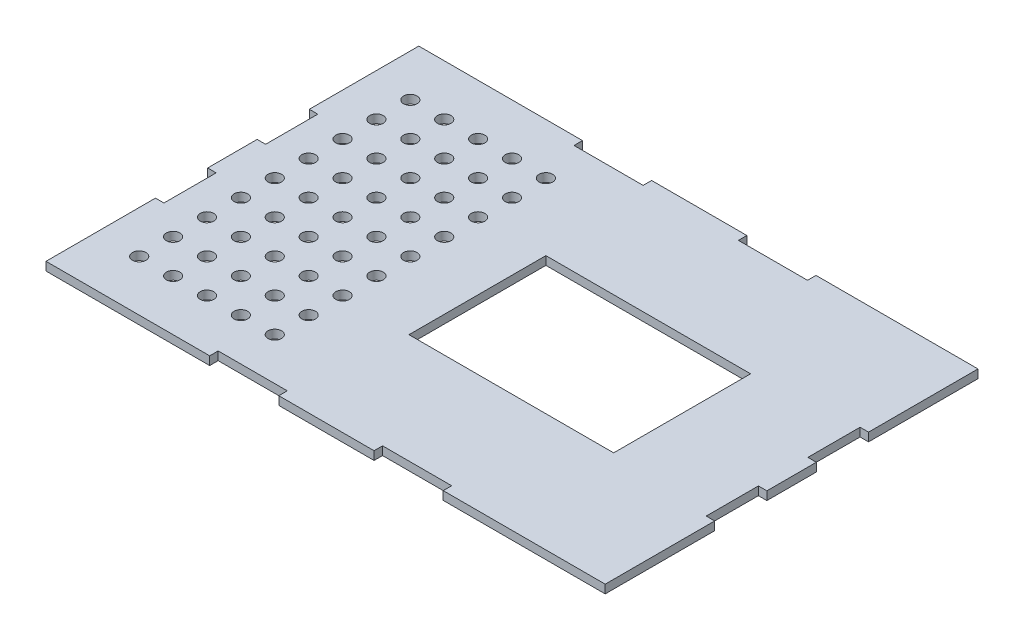
from build123d import *

# Parameters (mm, degrees)
SKETCH1_W           = 203.2
SKETCH1_H           = 133.35
BOSS_EXTRUDE1_DEPTH = 3.175
SKETCH2_R           = 2.54
CUT_EXTRUDE1_DEPTH  = 122.565604716
SKETCH3_W           = 35.687
SKETCH3_H           = 3.175
BOSS_EXTRUDE2_DEPTH = 3.175
SKETCH4_W           = 3.175
SKETCH4_H           = 18.542
BOSS_EXTRUDE3_DEPTH = 3.175
BOSS_EXTRUDE4_DEPTH = 3.175
SKETCH6_W           = 76.708
SKETCH6_H           = 51.308
CUT_EXTRUDE2_DEPTH  = 126.963898598


with BuildPart() as part:
    # Sketch1 → Boss-Extrude1 (new body)
    with BuildSketch(Plane(origin=(0, 0, 0), x_dir=(1, 0, 0), z_dir=(0, 1, 0))):
        Rectangle(SKETCH1_W, SKETCH1_H)
    extrude(amount=BOSS_EXTRUDE1_DEPTH)

    # Sketch2 → Cut-Extrude1 (cut, through all)
    with BuildSketch(Plane(origin=(0, 3.175, 0), x_dir=(1, 0, 0), z_dir=(0, 1, 0))):
        with Locations(Location((-88.9, 50.8, 0), (0, 0, 270))):
            Circle(SKETCH2_R)
        with Locations(Location((-76.2, 50.8, 0), (0, 0, 270))):
            Circle(SKETCH2_R)
        with Locations(Location((-63.5, 50.8, 0), (0, 0, 270))):
            Circle(SKETCH2_R)
        with Locations(Location((-50.8, 50.8, 0), (0, 0, 270))):
            Circle(SKETCH2_R)
        with Locations(Location((-76.2, 38.1, 0), (0, 0, 270))):
            Circle(SKETCH2_R)
        with Locations(Location((-63.5, 38.1, 0), (0, 0, 270))):
            Circle(SKETCH2_R)
        with Locations(Location((-50.8, 38.1, 0), (0, 0, 270))):
            Circle(SKETCH2_R)
        with Locations(Location((-76.2, 25.4, 0), (0, 0, 270))):
            Circle(SKETCH2_R)
        with Locations(Location((-63.5, 25.4, 0), (0, 0, 270))):
            Circle(SKETCH2_R)
        with Locations(Location((-50.8, 25.4, 0), (0, 0, 270))):
            Circle(SKETCH2_R)
        with Locations(Location((-76.2, 12.7, 0), (0, 0, 270))):
            Circle(SKETCH2_R)
        with Locations(Location((-63.5, 12.7, 0), (0, 0, 270))):
            Circle(SKETCH2_R)
        with Locations(Location((-50.8, 12.7, 0), (0, 0, 270))):
            Circle(SKETCH2_R)
        with Locations(Location((-76.2, 0, 0), (0, 0, 270))):
            Circle(SKETCH2_R)
        with Locations(Location((-63.5, 0, 0), (0, 0, 270))):
            Circle(SKETCH2_R)
        with Locations(Location((-50.8, 0, 0), (0, 0, 270))):
            Circle(SKETCH2_R)
        with Locations(Location((-76.2, -12.7, 0), (0, 0, 270))):
            Circle(SKETCH2_R)
        with Locations(Location((-63.5, -12.7, 0), (0, 0, 270))):
            Circle(SKETCH2_R)
        with Locations(Location((-50.8, -12.7, 0), (0, 0, 270))):
            Circle(SKETCH2_R)
        with Locations(Location((-76.2, -25.4, 0), (0, 0, 270))):
            Circle(SKETCH2_R)
        with Locations(Location((-63.5, -25.4, 0), (0, 0, 270))):
            Circle(SKETCH2_R)
        with Locations(Location((-50.8, -25.4, 0), (0, 0, 270))):
            Circle(SKETCH2_R)
        with Locations(Location((-76.2, -38.1, 0), (0, 0, 270))):
            Circle(SKETCH2_R)
        with Locations(Location((-63.5, -38.1, 0), (0, 0, 270))):
            Circle(SKETCH2_R)
        with Locations(Location((-50.8, -38.1, 0), (0, 0, 270))):
            Circle(SKETCH2_R)
        with Locations(Location((-76.2, -50.8, 0), (0, 0, 270))):
            Circle(SKETCH2_R)
        with Locations(Location((-63.5, -50.8, 0), (0, 0, 270))):
            Circle(SKETCH2_R)
        with Locations(Location((-50.8, -50.8, 0), (0, 0, 270))):
            Circle(SKETCH2_R)
        with Locations(Location((-88.9, 38.1, 0), (0, 0, 270))):
            Circle(SKETCH2_R)
        with Locations(Location((-88.9, 25.4, 0), (0, 0, 270))):
            Circle(SKETCH2_R)
        with Locations(Location((-88.9, 12.7, 0), (0, 0, 270))):
            Circle(SKETCH2_R)
        with Locations(Location((-88.9, 0, 0), (0, 0, 270))):
            Circle(SKETCH2_R)
        with Locations(Location((-88.9, -12.7, 0), (0, 0, 270))):
            Circle(SKETCH2_R)
        with Locations(Location((-88.9, -25.4, 0), (0, 0, 270))):
            Circle(SKETCH2_R)
        with Locations(Location((-88.9, -38.1, 0), (0, 0, 270))):
            Circle(SKETCH2_R)
        with Locations(Location((-88.9, -50.8, 0), (0, 0, 270))):
            Circle(SKETCH2_R)
        with Locations(Location((-38.1, 50.8, 0), (0, 0, 270))):
            Circle(SKETCH2_R)
        with Locations(Location((-38.1, 38.1, 0), (0, 0, 270))):
            Circle(SKETCH2_R)
        with Locations(Location((-38.1, 25.4, 0), (0, 0, 270))):
            Circle(SKETCH2_R)
        with Locations(Location((-38.1, 12.7, 0), (0, 0, 270))):
            Circle(SKETCH2_R)
        with Locations(Location((-38.1, 0, 0), (0, 0, 270))):
            Circle(SKETCH2_R)
        with Locations(Location((-38.1, -12.7, 0), (0, 0, 270))):
            Circle(SKETCH2_R)
        with Locations(Location((-38.1, -25.4, 0), (0, 0, 270))):
            Circle(SKETCH2_R)
        with Locations(Location((-38.1, -38.1, 0), (0, 0, 270))):
            Circle(SKETCH2_R)
        with Locations(Location((-38.1, -50.8, 0), (0, 0, 270))):
            Circle(SKETCH2_R)
    extrude(amount=-CUT_EXTRUDE1_DEPTH, mode=Mode.SUBTRACT)

    # Sketch3 → Boss-Extrude2 (add)
    with BuildSketch(Plane(origin=(0, 3.175, 0), x_dir=(1, 0, 0), z_dir=(0, 1, 0))):
        with Locations((-61.2775, 68.2625)):
            Rectangle(SKETCH3_W, SKETCH3_H)
        with Locations((0.3175, 68.2625)):
            Rectangle(SKETCH3_W, SKETCH3_H)
        with Locations((61.9125, 68.2625)):
            Rectangle(SKETCH3_W, SKETCH3_H)
        with Locations((61.9125, -68.2625)):
            Rectangle(SKETCH3_W, SKETCH3_H)
        with Locations((0.3175, -68.2625)):
            Rectangle(SKETCH3_W, SKETCH3_H)
        with Locations((-61.2775, -68.2625)):
            Rectangle(SKETCH3_W, SKETCH3_H)
    extrude(amount=-BOSS_EXTRUDE2_DEPTH)

    # Sketch4 → Boss-Extrude3 (add)
    with BuildSketch(Plane(origin=(0, 3.175, 0), x_dir=(1, 0, 0), z_dir=(0, 1, 0))):
        with Locations((-103.1875, 38.1)):
            Rectangle(SKETCH4_W, SKETCH4_H)
        with Locations((-103.1875, 0)):
            Rectangle(SKETCH4_W, SKETCH4_H)
        with Locations((-103.1875, -38.1)):
            Rectangle(SKETCH4_W, SKETCH4_H)
        with Locations((103.1875, -38.1)):
            Rectangle(SKETCH4_W, SKETCH4_H)
        with Locations((103.1875, 0)):
            Rectangle(SKETCH4_W, SKETCH4_H)
        with Locations((103.1875, 38.1)):
            Rectangle(SKETCH4_W, SKETCH4_H)
    extrude(amount=-BOSS_EXTRUDE3_DEPTH)

    # Sketch5 → Boss-Extrude4 (add)
    with BuildSketch(Plane(origin=(0, 3.175, 0), x_dir=(1, 0, 0), z_dir=(0, 1, 0))):
        Polygon((-104.775, -47.371), (-104.775, -69.85), (-79.121, -69.85), (-79.121, -66.675), (-101.6, -66.675), (-101.6, -47.371), align=None)
        Polygon((-101.6, 47.371), (-104.775, 47.371), (-104.775, 69.85), (-79.121, 69.85), (-79.121, 66.675), (-101.6, 66.675), align=None)
        Polygon((104.775, 47.371), (104.775, 69.85), (79.121, 69.85), (79.121, 66.675), (101.6, 66.675), (101.6, 47.371), align=None)
        Polygon((101.6, -47.371), (104.775, -47.371), (104.775, -69.85), (79.121, -69.85), (79.121, -66.675), (101.6, -66.675), align=None)
    extrude(amount=-BOSS_EXTRUDE4_DEPTH)

    # Sketch6 → Cut-Extrude2 (cut, through all)
    with BuildSketch(Plane(origin=(0, 3.175, 0), x_dir=(1, 0, 0), z_dir=(0, 1, 0))):
        with Locations((25.4, 0)):
            Rectangle(SKETCH6_W, SKETCH6_H)
    extrude(amount=-CUT_EXTRUDE2_DEPTH, mode=Mode.SUBTRACT)


solid = part.part
